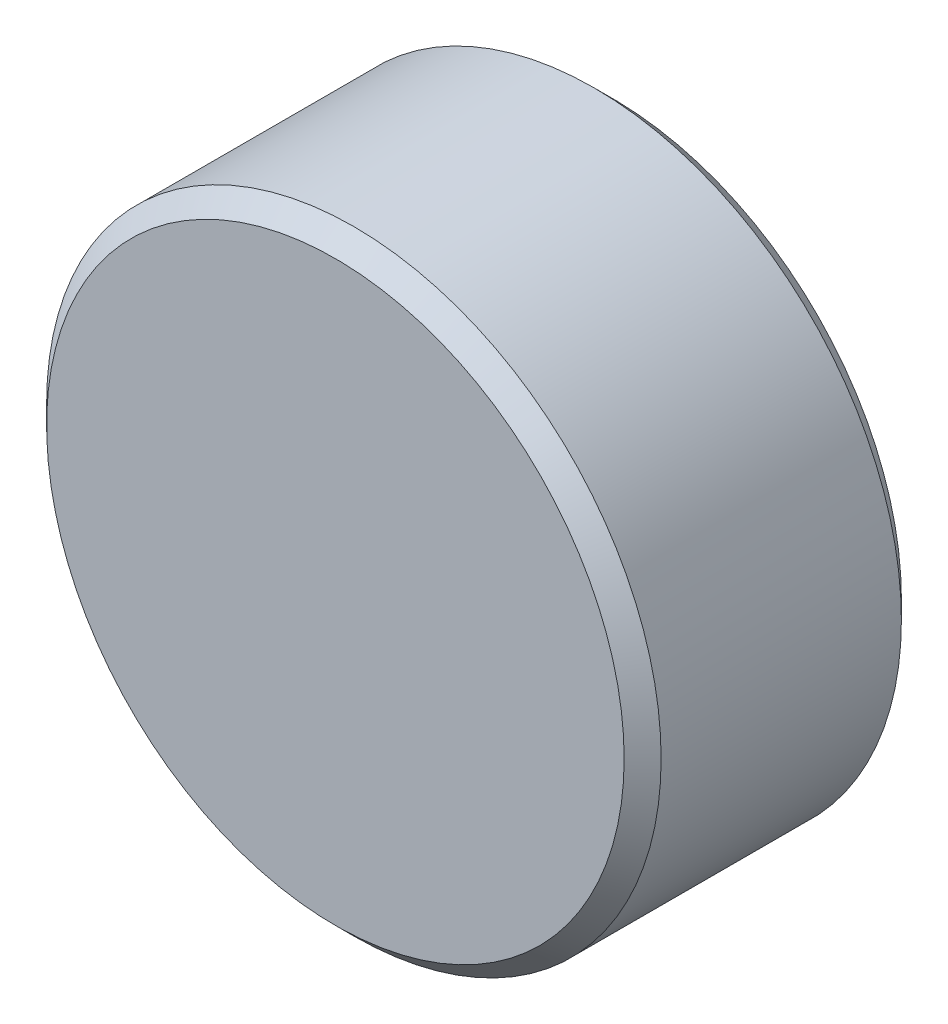
from build123d import *

# Parameters (mm, degrees)
ESQUISSE1_R      = 33.25
EXTRUSION1_DEPTH = 30
CHANFREIN1_SIZE  = 2
CHANFREIN2_SIZE  = 2


with BuildPart() as part:
    # Esquisse1 → Extrusion1 (new body)
    with BuildSketch(Plane.XY):
        Circle(ESQUISSE1_R)
    extrude(amount=EXTRUSION1_DEPTH)

    # Chanfrein1
    chanfrein1_edges = [part.edges().sort_by_distance(p)[0] for p in [
        (-33.25, 0, 30),
    ]]
    chamfer(chanfrein1_edges, length=CHANFREIN1_SIZE)

    # Chanfrein2
    chanfrein2_edges = [part.edges().sort_by_distance(p)[0] for p in [
        (-33.25, 0, 0),
    ]]
    chamfer(chanfrein2_edges, length=CHANFREIN2_SIZE)


solid = part.part
